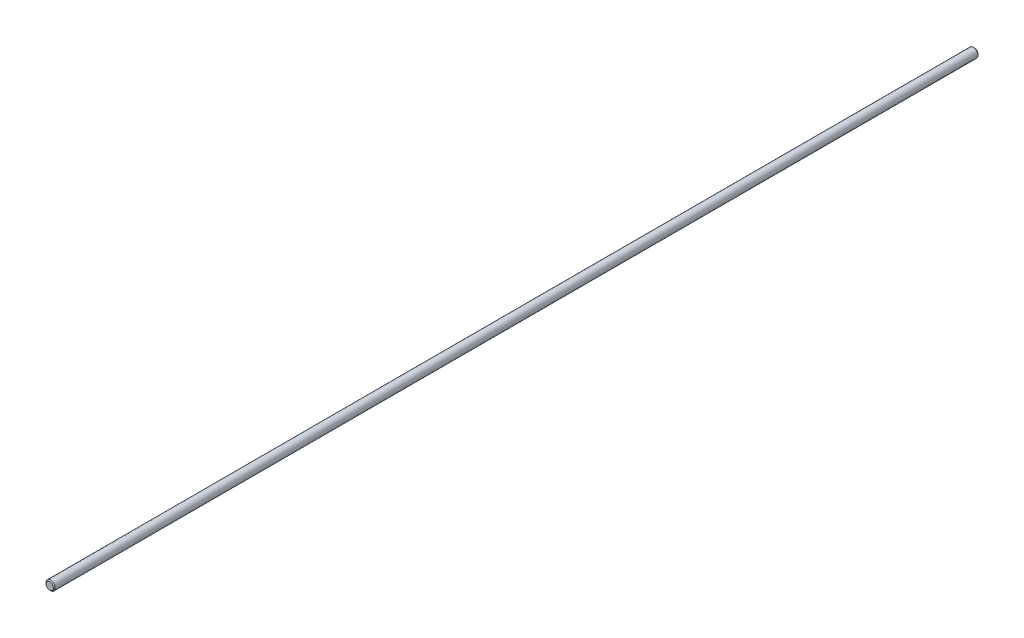
from build123d import *

# Parameters (mm, degrees)
SKETCH1_R           = 2.495
BOSS_EXTRUDE1_DEPTH = 500
CHAMFER1_SIZE       = 0.5


with BuildPart() as part:
    # Sketch1 → Boss-Extrude1 (new body)
    with BuildSketch(Plane.XY):
        Circle(SKETCH1_R)
    extrude(amount=BOSS_EXTRUDE1_DEPTH)

    # Chamfer1
    chamfer1_edges = [part.edges().sort_by_distance(p)[0] for p in [
        (-2.495, 0, 0),
        (-2.495, 0, 500),
    ]]
    chamfer(chamfer1_edges, length=CHAMFER1_SIZE)


solid = part.part
